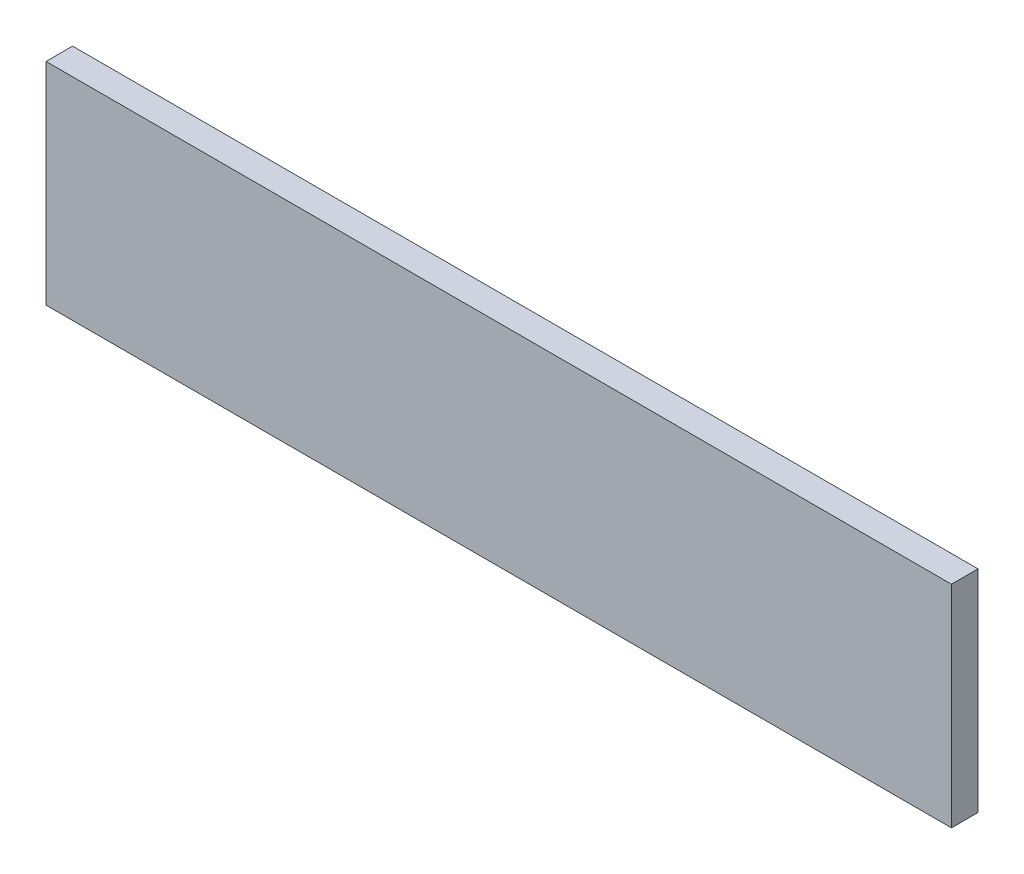
from build123d import *

# Parameters (mm, degrees)
SKETCH1_W           = 3.9
SKETCH1_H           = 31
BOSS_EXTRUDE1_DEPTH = 133


with BuildPart() as part:
    # Sketch1 → Boss-Extrude1 (new body)
    with BuildSketch(Plane(origin=(0, 0, 0), x_dir=(0, 0, -1), z_dir=(1, 0, 0))):
        Rectangle(SKETCH1_W, SKETCH1_H)
    extrude(amount=BOSS_EXTRUDE1_DEPTH)


solid = part.part
